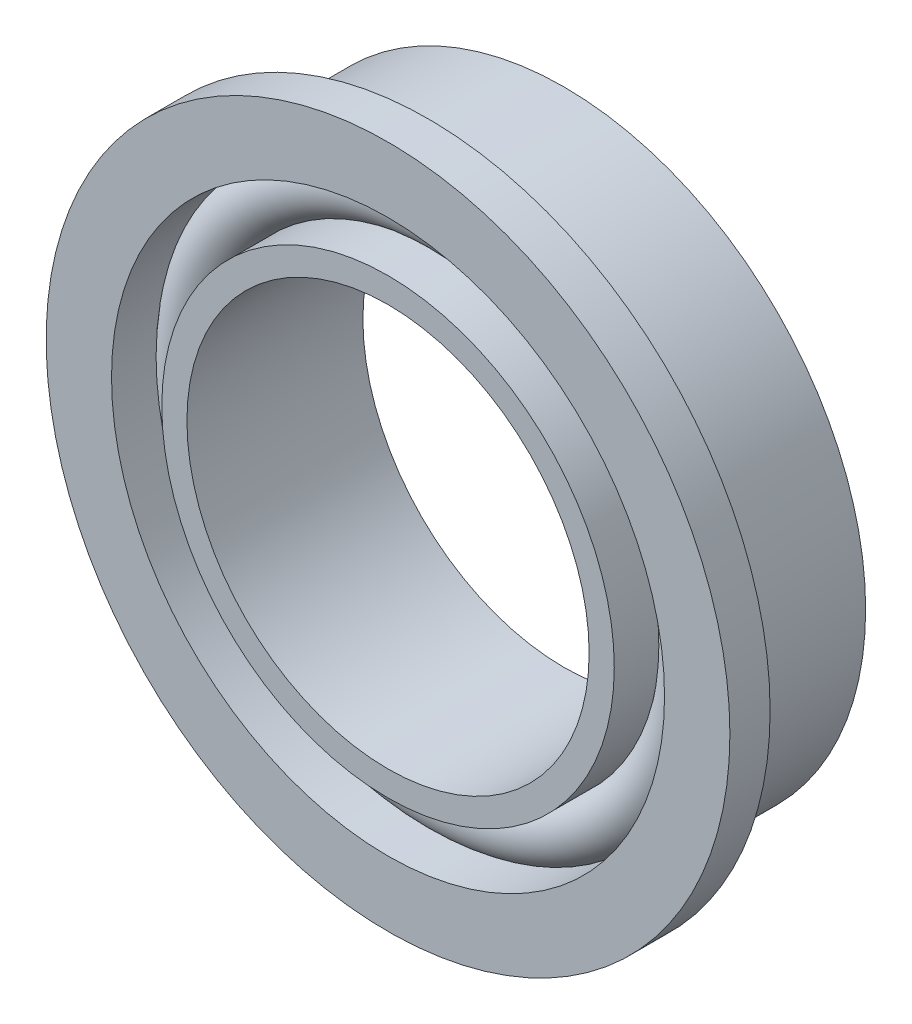
from build123d import *

# Parameters (mm, degrees)
SKETCH1_R           = 6
SKETCH1_R_2         = 4
BOSS_EXTRUDE1_DEPTH = 3.5
SKETCH4_R           = 5.5
SKETCH4_R_2         = 4.5
CUT_EXTRUDE1_DEPTH  = 41.1
SKETCH6_R           = 0.6
SKETCH8_R           = 6.8
SKETCH8_R_2         = 6
BOSS_EXTRUDE3_DEPTH = 0.8


with BuildPart() as part:
    # Sketch1 → Boss-Extrude1 (new body)
    with BuildSketch(Plane.XY):
        Circle(SKETCH1_R)
        Circle(SKETCH1_R_2, mode=Mode.SUBTRACT)
    extrude(amount=BOSS_EXTRUDE1_DEPTH)

    # Sketch4 → Cut-Extrude1 (cut)
    with BuildSketch(Plane.XY.offset(3.5)):
        Circle(SKETCH4_R)
        Circle(SKETCH4_R_2, mode=Mode.SUBTRACT)
    extrude(amount=-CUT_EXTRUDE1_DEPTH, mode=Mode.SUBTRACT)


with BuildPart() as cut_extrude1_piece_1:
    # of the separate pieces the step leaves, piece 1, a body of its own (cut_extrude1_pieces)
    add(part.part.solids().sort_by_distance((6, 0, 0))[0])



with BuildPart() as cut_extrude1_piece_2:
    # of the separate pieces the step leaves, piece 2, a body of its own (cut_extrude1_pieces)
    add(part.part.solids().sort_by_distance((4.5, 0, 0))[0])


with BuildPart() as cut_extrude1_piece_1_1:
    add(cut_extrude1_piece_1.part)

    add(cut_extrude1_piece_2.part)  # Revolve1 merges Cut-Extrude1 piece 2
    # Sketch6 → Revolve1 (revolve)
    with BuildSketch(Plane(origin=(0, 0, 0), x_dir=(1, 0, 0), z_dir=(0, 1, 0)), mode=Mode.PRIVATE) as revolve1_sk:
        with Locations((-5, -2.265265141)):
            Circle(SKETCH6_R)
    revolve(revolve1_sk.sketch.rotate(Axis((0, 0, 3.5), (0, 0, -1)), 180), axis=Axis((0, 0, 3.5), (0, 0, -1)))

    # Sketch8 → Boss-Extrude3 (add)
    with BuildSketch(Plane.XY.offset(3.5)):
        Circle(SKETCH8_R)
        Circle(SKETCH8_R_2, mode=Mode.SUBTRACT)
    extrude(amount=-BOSS_EXTRUDE3_DEPTH)


solid = cut_extrude1_piece_1_1.part
